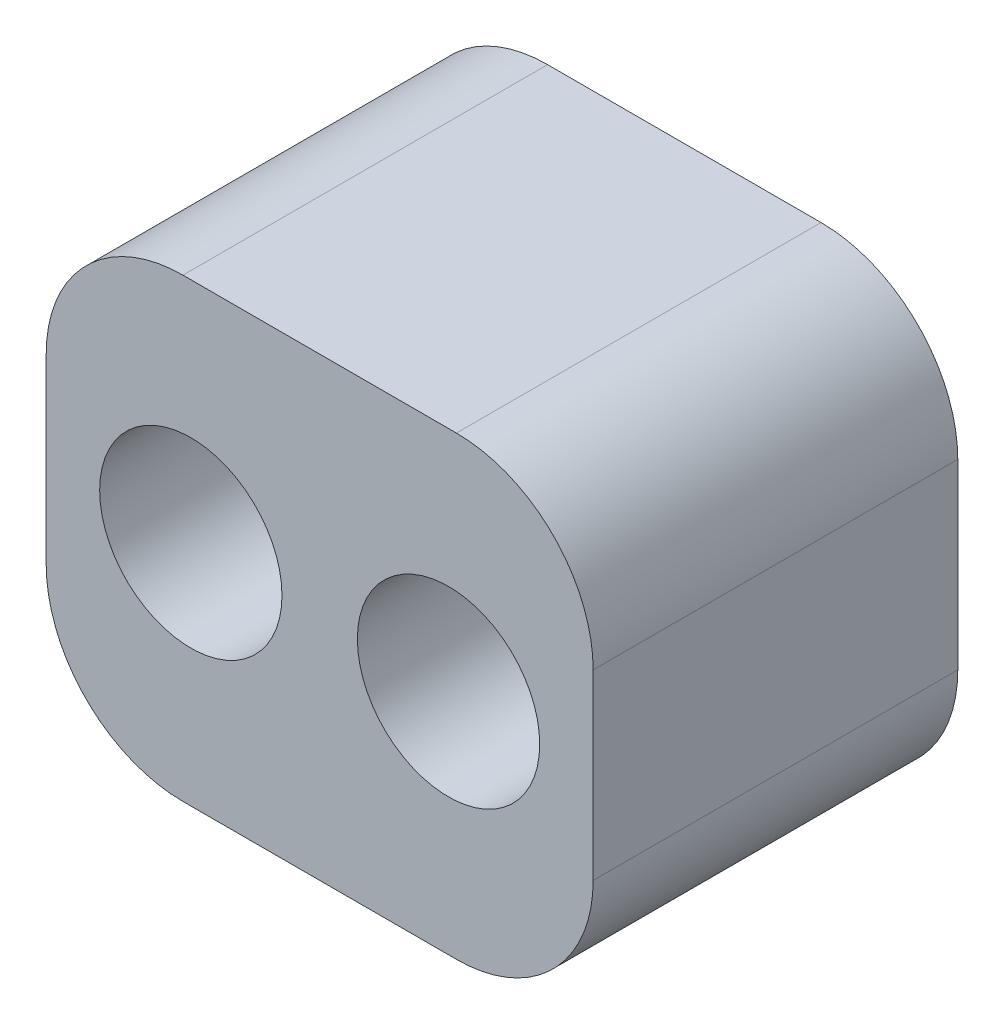
from build123d import *

# Parameters (mm, degrees)
SKETCH1_W           = 6
SKETCH1_H           = 5
SKETCH1_R           = 1
BOSS_EXTRUDE1_DEPTH = 4
FILLET1_R           = 1.5


with BuildPart() as part:
    # Sketch1 → Boss-Extrude1 (new body)
    with BuildSketch(Plane.XY):
        Rectangle(SKETCH1_W, SKETCH1_H)
        with Locations((1.413625544, 0)):
            Circle(SKETCH1_R, mode=Mode.SUBTRACT)
        with Locations(Location((-1.413625544, 0, 0), (0, 0, 180))):
            Circle(SKETCH1_R, mode=Mode.SUBTRACT)
    extrude(amount=BOSS_EXTRUDE1_DEPTH)

    # Fillet1
    fillet1_edges = [part.edges().sort_by_distance(p)[0] for p in [
        (3, -2.5, 2),
        (-3, -2.5, 2),
        (-3, 2.5, 2),
        (3, 2.5, 2),
    ]]
    fillet(fillet1_edges, radius=FILLET1_R)


solid = part.part
